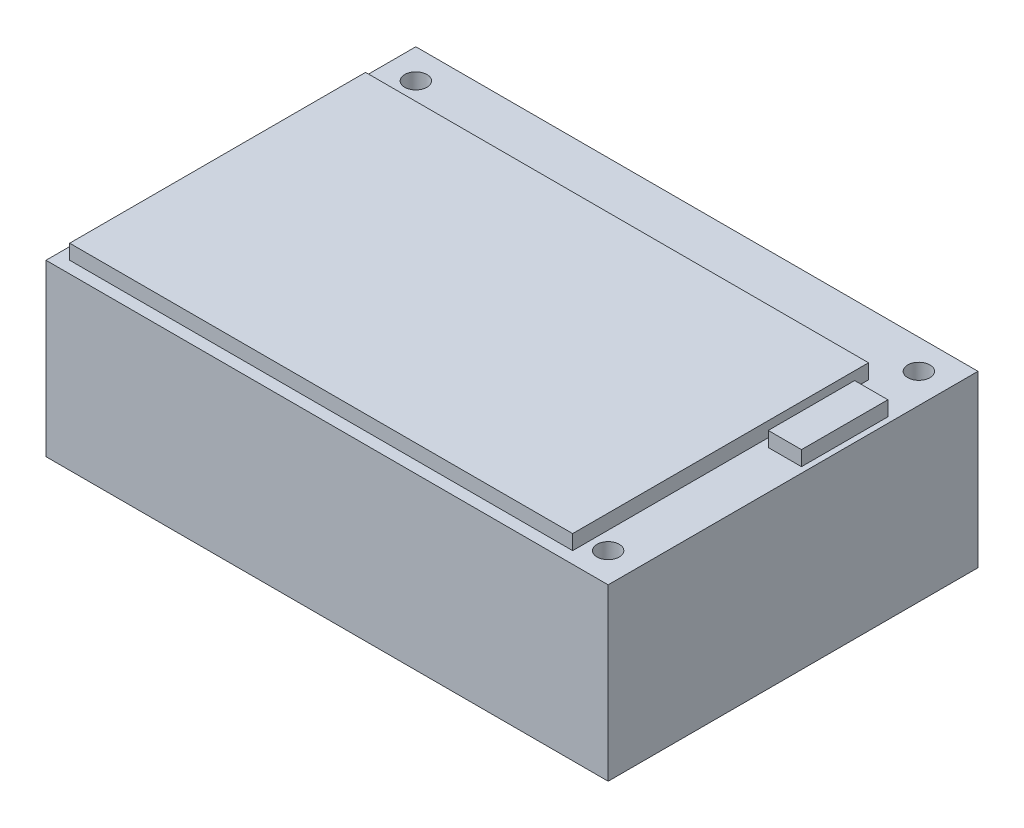
from build123d import *

# Parameters (mm, degrees)
SKETCH1_W           = 96.52
SKETCH1_H           = 63.5
SKETCH1_R           = 1.905
BOSS_EXTRUDE1_DEPTH = 29.21
SKETCH2_W           = 86.36
SKETCH2_H           = 50.8
SKETCH2_W_2         = 5.705747077
SKETCH2_H_2         = 14.834942399
BOSS_EXTRUDE2_DEPTH = 2.54
SKETCH3_R           = 1.27
CUT_EXTRUDE1_DEPTH  = 2.54
SKETCH4_W           = 7.62
SKETCH4_H           = 6.35
SKETCH4_W_2         = 10.16
BOSS_EXTRUDE3_DEPTH = 10.16


with BuildPart() as part:
    # Sketch1 → Boss-Extrude1 (new body)
    with BuildSketch(Plane(origin=(0, 0, 0), x_dir=(1, 0, 0), z_dir=(0, 1, 0))):
        Rectangle(SKETCH1_W, SKETCH1_H)
        with Locations(Location((-43.18, 26.67, 0), (0, 0, 90))):
            Circle(SKETCH1_R, mode=Mode.SUBTRACT)
        with Locations(Location((43.18, 26.67, 0), (0, 0, 90))):
            Circle(SKETCH1_R, mode=Mode.SUBTRACT)
        with Locations(Location((43.18, -26.67, 0), (0, 0, 90))):
            Circle(SKETCH1_R, mode=Mode.SUBTRACT)
        with Locations(Location((-43.18, -26.67, 0), (0, 0, 90))):
            Circle(SKETCH1_R, mode=Mode.SUBTRACT)
    extrude(amount=BOSS_EXTRUDE1_DEPTH)

    # Sketch2 → Boss-Extrude2 (add)
    with BuildSketch(Plane(origin=(0, 29.21, 0), x_dir=(1, 0, 0), z_dir=(0, 1, 0))):
        with Locations((-3.048, -4.318)):
            Rectangle(SKETCH2_W, SKETCH2_H)
        with Locations((44.441430006, 9.82656441)):
            Rectangle(SKETCH2_W_2, SKETCH2_H_2)
    extrude(amount=BOSS_EXTRUDE2_DEPTH)

    # Sketch3 → Cut-Extrude1 (cut)
    with BuildSketch(Plane.XZ):
        with Locations(Location((-25.4, 12.7, 0), (0, 0, 270))):
            Circle(SKETCH3_R)
    extrude(amount=-CUT_EXTRUDE1_DEPTH, mode=Mode.SUBTRACT)

    # Sketch4 → Boss-Extrude3 (add)
    with BuildSketch(Plane(origin=(0, 0, -31.75), x_dir=(-1, 0, 0), z_dir=(0, 0, -1))):
        with Locations((-31.496, 10.287)):
            Rectangle(SKETCH4_W, SKETCH4_H)
        with Locations((-20.32, 10.287)):
            Rectangle(SKETCH4_W_2, SKETCH4_H)
        with Locations((-8.382, 10.287)):
            Rectangle(SKETCH4_W, SKETCH4_H)
        with Locations((2.54, 10.287)):
            Rectangle(SKETCH4_W_2, SKETCH4_H)
    extrude(amount=BOSS_EXTRUDE3_DEPTH)


solid = part.part
